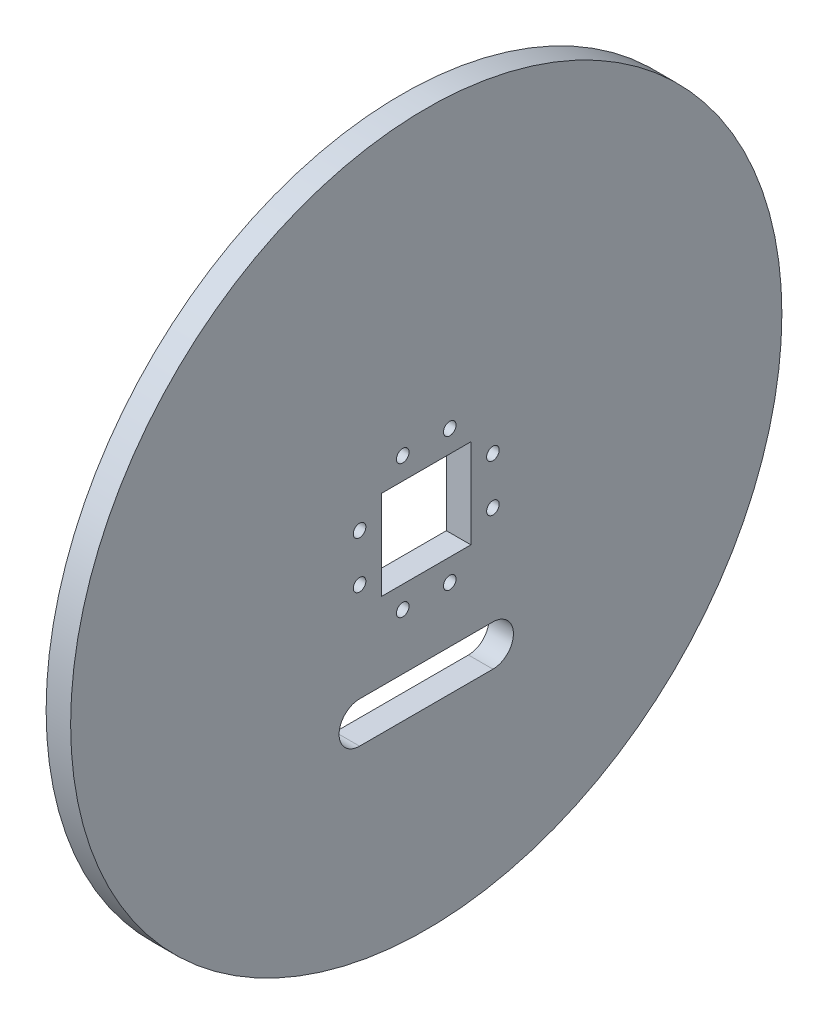
from build123d import *

# Parameters (mm, degrees)
SKETCH1_R           = 101.6
SKETCH1_R_2         = 1.8
SKETCH1_W           = 25.5
SKETCH1_H           = 25.5
BOSS_EXTRUDE2_DEPTH = 7


with BuildPart() as part:
    # Sketch1 → Boss-Extrude2 (new body)
    with BuildSketch(Plane(origin=(0, 0, 0), x_dir=(0, 0, -1), z_dir=(1, 0, 0))):
        Circle(SKETCH1_R)
        with Locations((19.05, 6.718444761)):
            Circle(SKETCH1_R_2, mode=Mode.SUBTRACT)
        with Locations((19.05, -6.718444761)):
            Circle(SKETCH1_R_2, mode=Mode.SUBTRACT)
        with Locations((-6.718444761, -19.05)):
            Circle(SKETCH1_R_2, mode=Mode.SUBTRACT)
        with Locations((6.718444761, -19.05)):
            Circle(SKETCH1_R_2, mode=Mode.SUBTRACT)
        with Locations((-19.05, 6.718444761)):
            Circle(SKETCH1_R_2, mode=Mode.SUBTRACT)
        with Locations((-19.05, -6.718444761)):
            Circle(SKETCH1_R_2, mode=Mode.SUBTRACT)
        with Locations((6.718444761, 19.05)):
            Circle(SKETCH1_R_2, mode=Mode.SUBTRACT)
        with Locations((-6.718444761, 19.05)):
            Circle(SKETCH1_R_2, mode=Mode.SUBTRACT)
        Rectangle(SKETCH1_W, SKETCH1_H, mode=Mode.SUBTRACT)
        with BuildLine():
            Line((-19.05, -34.96193786), (19.05, -34.96193786))
            ThreePointArc((19.05, -34.96193786), (24.895725944, -40.807663805), (19.05, -46.653389749))
            Line((19.05, -46.653389749), (-19.05, -46.653389749))
            ThreePointArc((-19.05, -46.653389749), (-24.895725944, -40.807663805), (-19.05, -34.96193786))
        make_face(mode=Mode.SUBTRACT)
    extrude(amount=BOSS_EXTRUDE2_DEPTH)


solid = part.part
